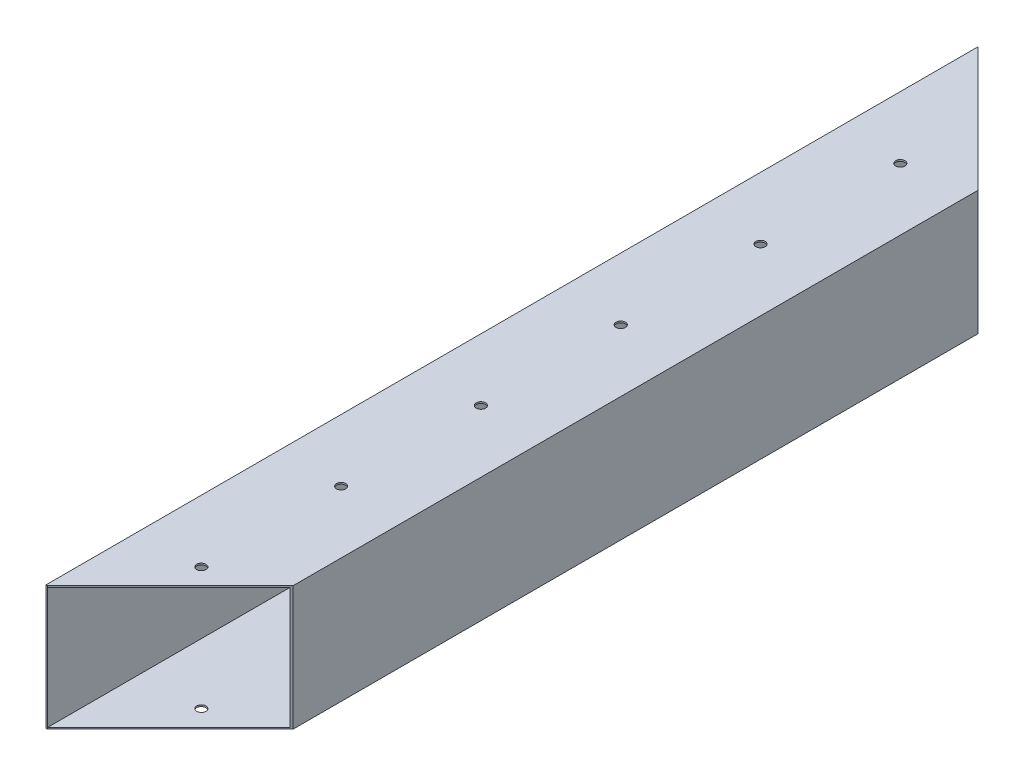
from build123d import *

# Parameters (mm, degrees)
CROQUIS1_W              = 40
CROQUIS1_H              = 40
CROQUIS1_W_2            = 39
CROQUIS1_H_2            = 39
SALIENTE_EXTRUIR2_DEPTH = 300
CORTAR_EXTRUIR1_DEPTH   = 300
CORTAR_EXTRUIR2_DEPTH   = 300
CROQUIS4_R              = 1.5
CORTAR_EXTRUIR3_DEPTH   = 550


with BuildPart() as part:
    # Croquis1 → Saliente-Extruir2 (new body)
    with BuildSketch(Plane.XY):
        Rectangle(CROQUIS1_W, CROQUIS1_H)
        Rectangle(CROQUIS1_W_2, CROQUIS1_H_2, mode=Mode.SUBTRACT)
    extrude(amount=SALIENTE_EXTRUIR2_DEPTH)

    # Croquis2 → Cortar-Extruir1 (cut)
    with BuildSketch(Plane(origin=(0, 20, 0), x_dir=(1, 0, 0), z_dir=(0, 1, 0))):
        Polygon((-19.5, -300), (20, -260.5), (20, -300), align=None)
    extrude(amount=-CORTAR_EXTRUIR1_DEPTH, mode=Mode.SUBTRACT)

    # Croquis3 → Cortar-Extruir2 (cut)
    with BuildSketch(Plane.XZ.offset(20)):
        Polygon((-20, 0), (20, 40), (20, 0), align=None)
    extrude(amount=-CORTAR_EXTRUIR2_DEPTH, mode=Mode.SUBTRACT)

    # Croquis4 → Cortar-Extruir3 (cut)
    with BuildSketch(Plane.XZ.offset(20)):
        with Locations(Location((0, 45, 0), (0, 0, 270))):
            Circle(CROQUIS4_R)
        with Locations(Location((0, 90, 0), (0, 0, 270))):
            Circle(CROQUIS4_R)
        with Locations(Location((0, 135, 0), (0, 0, 270))):
            Circle(CROQUIS4_R)
        with Locations(Location((0, 180, 0), (0, 0, 270))):
            Circle(CROQUIS4_R)
        with Locations(Location((0, 225, 0), (0, 0, 270))):
            Circle(CROQUIS4_R)
        with Locations(Location((0, 270, 0), (0, 0, 270))):
            Circle(CROQUIS4_R)
    extrude(amount=-CORTAR_EXTRUIR3_DEPTH, mode=Mode.SUBTRACT)


solid = part.part
